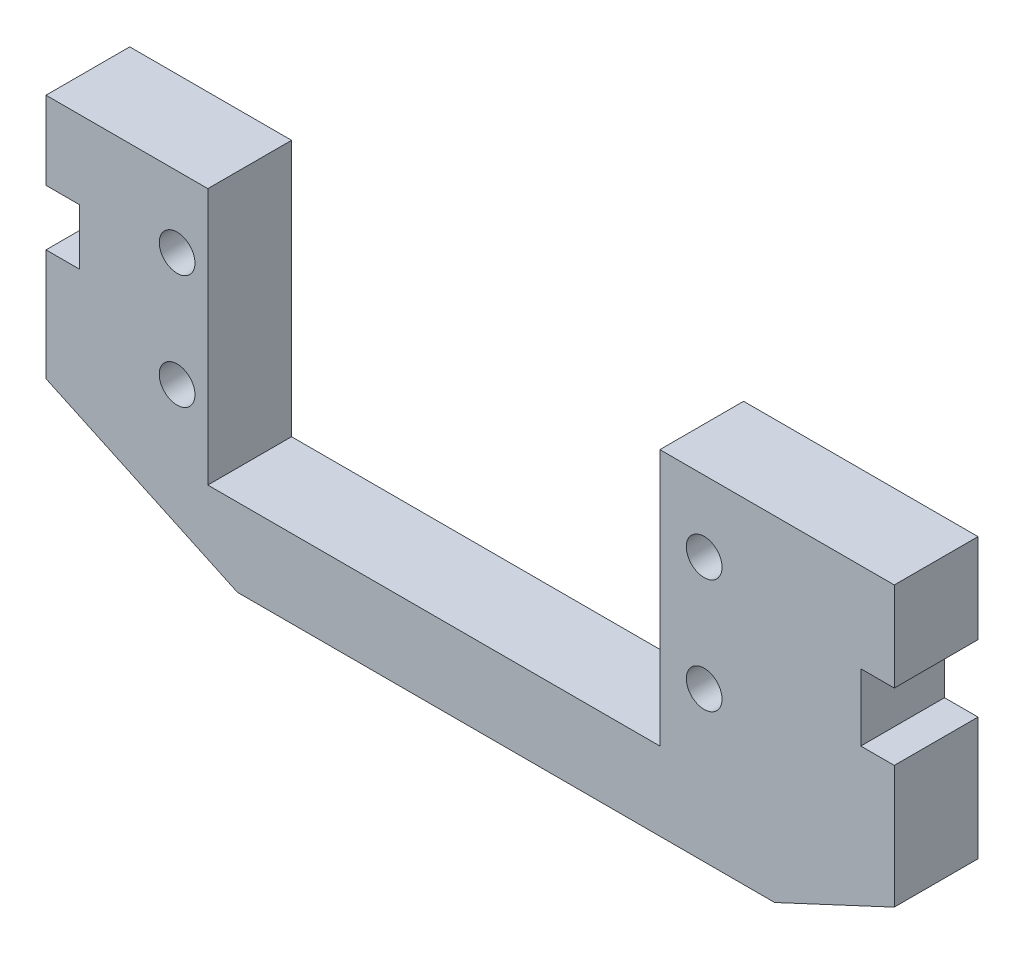
from build123d import *

# Parameters (mm, degrees)
BOSS_EXTRU_1_DEPTH      = 7.5
ESQUISSE2_R             = 1.6
ENL_V_MAT_EXTRU_1_DEPTH = 83.050289457
CHANFREIN1_SIZE         = 8
CHANFREIN1_SIZE2        = 17.156055364
CHANFREIN2_SIZE         = 5
CHANFREIN2_SIZE2        = 10.722534603
ESQUISSE3_W             = 3
ESQUISSE3_H             = 6
ESQUISSE3_H_2           = 5
ENL_V_MAT_EXTRU_2_DEPTH = 83.050289457


with BuildPart() as part:
    # Esquisse1 → Boss.-Extru.1 (new body)
    with BuildSketch(Plane.XY):
        Polygon((0, 0), (0, -30), (76, -30), (76, 0), (55, 0), (55, -23), (14.5, -23), (14.5, 0), align=None)
    extrude(amount=BOSS_EXTRU_1_DEPTH)

    # Esquisse2 → Enlèv. mat.-Extru.1 (cut, through all)
    with BuildSketch(Plane(origin=(0, 0, 0), x_dir=(-1, 0, 0), z_dir=(0, 0, -1))):
        with Locations((-11.746558558, -16.576326178)):
            Circle(ESQUISSE2_R)
        with Locations((-11.746558558, -6.348778822)):
            Circle(ESQUISSE2_R)
        with Locations((-58.966054895, -16.576326178)):
            Circle(ESQUISSE2_R)
        with Locations((-58.966054895, -6.348778822)):
            Circle(ESQUISSE2_R)
    extrude(amount=-ENL_V_MAT_EXTRU_1_DEPTH, mode=Mode.SUBTRACT)

    # Chanfrein1
    chanfrein1_edges = [part.edges().sort_by_distance(p)[0] for p in [
        (0, -30, 3.75),
    ]]
    chanfrein1_side = [part.faces().sort_by_distance(p)[0] for p in [
        (0, -15, 3.75),
    ]]
    chamfer(chanfrein1_edges, length=CHANFREIN1_SIZE, length2=CHANFREIN1_SIZE2, reference=chanfrein1_side[0])

    # Chanfrein2
    chanfrein2_edges = [part.edges().sort_by_distance(p)[0] for p in [
        (76, -30, 3.75),
    ]]
    chanfrein2_side = [part.faces().sort_by_distance(p)[0] for p in [
        (76, -15, 3.75),
    ]]
    chamfer(chanfrein2_edges, length=CHANFREIN2_SIZE, length2=CHANFREIN2_SIZE2, reference=chanfrein2_side[0])

    # Esquisse3 → Enlèv. mat.-Extru.2 (cut, through all)
    with BuildSketch(Plane.XY.offset(7.5)):
        with Locations((74.5, -11)):
            Rectangle(ESQUISSE3_W, ESQUISSE3_H)
        with Locations((1.5, -9.5)):
            Rectangle(ESQUISSE3_W, ESQUISSE3_H_2)
    extrude(amount=-ENL_V_MAT_EXTRU_2_DEPTH, mode=Mode.SUBTRACT)


solid = part.part
